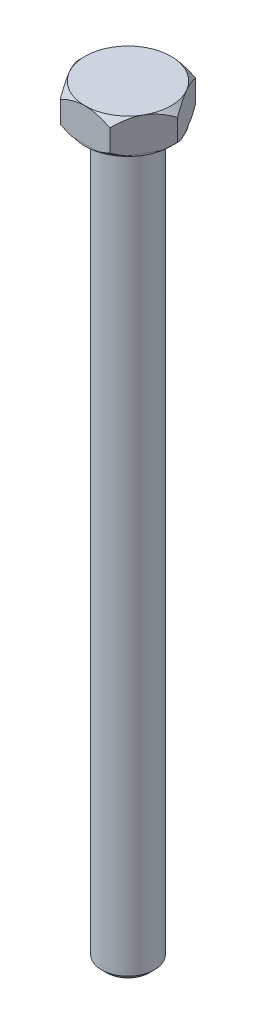
from build123d import *

# Parameters (mm, degrees)
BOSS_EXTRUDE1_DEPTH = 5.3
SKETCH2_OUTSIDE_W   = 21.122
SKETCH2_OUTSIDE_H   = 19.11
SKETCH2_OUTSIDE_R   = 6.5
CUT_EXTRUDE1_DEPTH  = 0.265
SKETCH3_R           = 4
BOSS_EXTRUDE2_DEPTH = 110
CHAMFER1_SIZE       = 0.8


with BuildPart() as part:
    # Sketch1 → Boss-Extrude1 (new body)
    with BuildSketch(Plane(origin=(0, 0, 0), x_dir=(1, 0, 0), z_dir=(0, 1, 0))):
        Polygon((7.505553499, 0), (3.75277675, 6.5), (-3.75277675, 6.5), (-7.505553499, 0), (-3.75277675, -6.5), (3.75277675, -6.5), align=None)
    extrude(amount=-BOSS_EXTRUDE1_DEPTH)

    # Sketch4 → Cut-Revolve1 (revolve, cut)
    with BuildSketch(Plane(origin=(0, 0, 0), x_dir=(0, 0, -1), z_dir=(1, 0, 0))):
        Polygon((-6.5, 0), (-8.15, 0), (-8.15, -1.65), align=None)
        Polygon((-8.15, -3.65), (-6.5, -5.3), (-8.15, -5.3), align=None)
    revolve(axis=Axis((0, 0, 0), (0, -1, 0)), mode=Mode.SUBTRACT)

    # Sketch2 outside → Cut-Extrude1 (cut)
    with BuildSketch(Plane.XZ.offset(5.3)):
        Rectangle(SKETCH2_OUTSIDE_W, SKETCH2_OUTSIDE_H)
        with Locations(Location((0, 0, 0), (0, 0, 90))):
            Circle(SKETCH2_OUTSIDE_R, mode=Mode.SUBTRACT)
    extrude(amount=-CUT_EXTRUDE1_DEPTH, mode=Mode.SUBTRACT)

    # Sketch3 → Boss-Extrude2 (add)
    with BuildSketch(Plane.XZ.offset(5.3)):
        with Locations(Location((0, 0, 0), (0, 0, 90))):
            Circle(SKETCH3_R)
    extrude(amount=BOSS_EXTRUDE2_DEPTH)

    # Chamfer1
    chamfer1_edges = [part.edges().sort_by_distance(p)[0] for p in [
        (0, -115.3, -4),
    ]]
    chamfer(chamfer1_edges, length=CHAMFER1_SIZE)


solid = part.part
